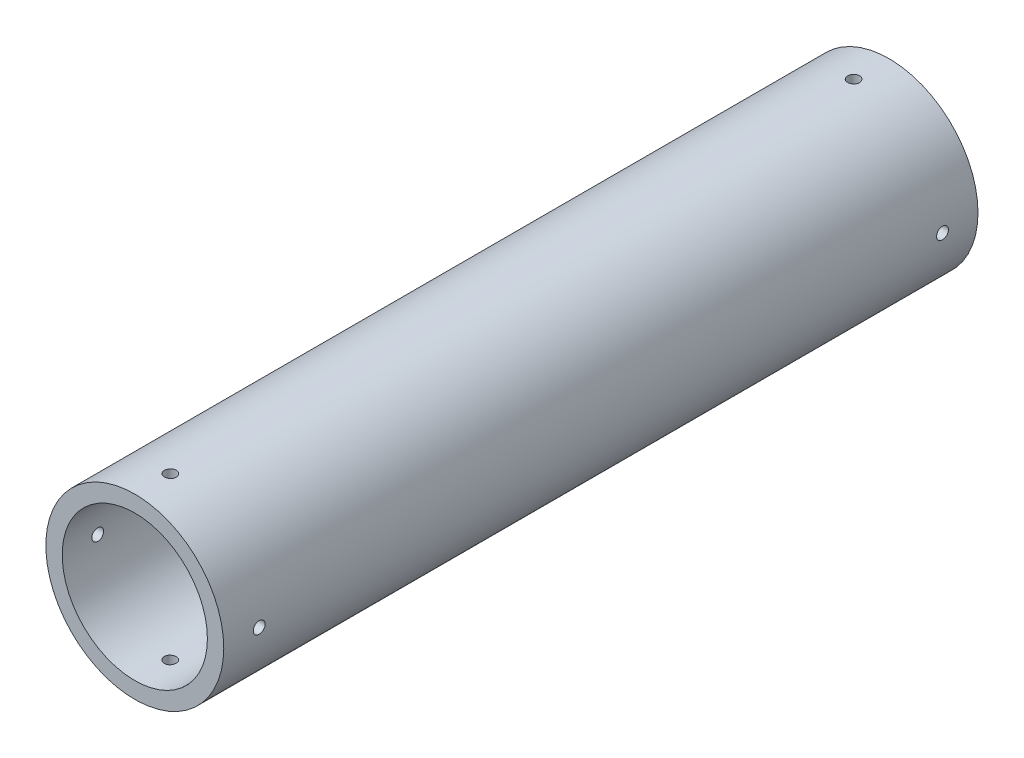
from build123d import *

# Parameters (mm, degrees)
SKETCH1_R                           = 30.099
SKETCH1_R_2                         = 24.5618
BOSS_EXTRUDE1_DEPTH                 = 255.2
F_4_0MM_DOWEL_HOLE1_D               = 4
F_4_0MM_DOWEL_HOLE1_DEPTH           = 6
F_4_0MM_DOWEL_HOLE1_TIP             = 1.201721238
F_4_0MM_DOWEL_HOLE1_ON_FACE_2_D     = 4
F_4_0MM_DOWEL_HOLE1_ON_FACE_2_DEPTH = 6
F_4_0MM_DOWEL_HOLE1_ON_FACE_2_TIP   = 1.201721238
F_4_0MM_DOWEL_HOLE1_ON_FACE_3_D     = 4
F_4_0MM_DOWEL_HOLE1_ON_FACE_3_DEPTH = 6
F_4_0MM_DOWEL_HOLE1_ON_FACE_3_TIP   = 1.201721238
F_4_0MM_DOWEL_HOLE1_ON_FACE_4_D     = 4
F_4_0MM_DOWEL_HOLE1_ON_FACE_4_DEPTH = 6
F_4_0MM_DOWEL_HOLE1_ON_FACE_4_TIP   = 1.201721238
F_4_0MM_DOWEL_HOLE2_D               = 4
F_4_0MM_DOWEL_HOLE2_DEPTH           = 6
F_4_0MM_DOWEL_HOLE2_TIP             = 1.201721238
F_4_0MM_DOWEL_HOLE2_ON_FACE_2_D     = 4
F_4_0MM_DOWEL_HOLE2_ON_FACE_2_DEPTH = 6
F_4_0MM_DOWEL_HOLE2_ON_FACE_2_TIP   = 1.201721238
F_4_0MM_DOWEL_HOLE2_ON_FACE_3_D     = 4
F_4_0MM_DOWEL_HOLE2_ON_FACE_3_DEPTH = 6
F_4_0MM_DOWEL_HOLE2_ON_FACE_3_TIP   = 1.201721238
F_4_0MM_DOWEL_HOLE2_ON_FACE_4_D     = 4
F_4_0MM_DOWEL_HOLE2_ON_FACE_4_DEPTH = 6
F_4_0MM_DOWEL_HOLE2_ON_FACE_4_TIP   = 1.201721238


with BuildPart() as part:
    # Sketch1 → Boss-Extrude1 (new body)
    with BuildSketch(Plane.XY):
        Circle(SKETCH1_R)
        Circle(SKETCH1_R_2, mode=Mode.SUBTRACT)
    extrude(amount=BOSS_EXTRUDE1_DEPTH)

    # Ø4.0mm Dowel Hole1
    with Locations(Plane(origin=(0, 30.099, 12), x_dir=(1, 0, 0), z_dir=(0, 1, 0))):
        with Locations((0, 0)):
            Hole(F_4_0MM_DOWEL_HOLE1_D / 2, depth=F_4_0MM_DOWEL_HOLE1_DEPTH)
            with Locations((0, 0, -(F_4_0MM_DOWEL_HOLE1_DEPTH + F_4_0MM_DOWEL_HOLE1_TIP / 2))):  # 118° drill point
                Cone(0, F_4_0MM_DOWEL_HOLE1_D / 2, F_4_0MM_DOWEL_HOLE1_TIP, mode=Mode.SUBTRACT)

    # Ø4.0mm Dowel Hole1 on face 2
    with Locations(Plane(origin=(30.099, 0, 12), x_dir=(0, 0, 1), z_dir=(1, 0, 0))):
        with Locations((0, 0)):
            Hole(F_4_0MM_DOWEL_HOLE1_ON_FACE_2_D / 2, depth=F_4_0MM_DOWEL_HOLE1_ON_FACE_2_DEPTH)
            with Locations((0, 0, -(F_4_0MM_DOWEL_HOLE1_ON_FACE_2_DEPTH + F_4_0MM_DOWEL_HOLE1_ON_FACE_2_TIP / 2))):  # 118° drill point
                Cone(0, F_4_0MM_DOWEL_HOLE1_ON_FACE_2_D / 2, F_4_0MM_DOWEL_HOLE1_ON_FACE_2_TIP, mode=Mode.SUBTRACT)

    # Ø4.0mm Dowel Hole1 on face 3
    with Locations(Plane(origin=(0, -30.099, 12), x_dir=(0, 0, -1), z_dir=(0, -1, 0))):
        with Locations((0, 0)):
            Hole(F_4_0MM_DOWEL_HOLE1_ON_FACE_3_D / 2, depth=F_4_0MM_DOWEL_HOLE1_ON_FACE_3_DEPTH)
            with Locations((0, 0, -(F_4_0MM_DOWEL_HOLE1_ON_FACE_3_DEPTH + F_4_0MM_DOWEL_HOLE1_ON_FACE_3_TIP / 2))):  # 118° drill point
                Cone(0, F_4_0MM_DOWEL_HOLE1_ON_FACE_3_D / 2, F_4_0MM_DOWEL_HOLE1_ON_FACE_3_TIP, mode=Mode.SUBTRACT)

    # Ø4.0mm Dowel Hole1 on face 4
    with Locations(Plane(origin=(-30.099, 0, 12), x_dir=(0, 0, -1), z_dir=(-1, 0, 0))):
        with Locations((0, 0)):
            Hole(F_4_0MM_DOWEL_HOLE1_ON_FACE_4_D / 2, depth=F_4_0MM_DOWEL_HOLE1_ON_FACE_4_DEPTH)
            with Locations((0, 0, -(F_4_0MM_DOWEL_HOLE1_ON_FACE_4_DEPTH + F_4_0MM_DOWEL_HOLE1_ON_FACE_4_TIP / 2))):  # 118° drill point
                Cone(0, F_4_0MM_DOWEL_HOLE1_ON_FACE_4_D / 2, F_4_0MM_DOWEL_HOLE1_ON_FACE_4_TIP, mode=Mode.SUBTRACT)

    # Ø4.0mm Dowel Hole2
    with Locations(Plane(origin=(0, -30.099, 243.2), x_dir=(-1, 0, 0), z_dir=(0, -1, 0))):
        with Locations((0, 0)):
            Hole(F_4_0MM_DOWEL_HOLE2_D / 2, depth=F_4_0MM_DOWEL_HOLE2_DEPTH)
            with Locations((0, 0, -(F_4_0MM_DOWEL_HOLE2_DEPTH + F_4_0MM_DOWEL_HOLE2_TIP / 2))):  # 118° drill point
                Cone(0, F_4_0MM_DOWEL_HOLE2_D / 2, F_4_0MM_DOWEL_HOLE2_TIP, mode=Mode.SUBTRACT)

    # Ø4.0mm Dowel Hole2 on face 2
    with Locations(Plane(origin=(-30.099, 0, 243.2), x_dir=(0, 0, -1), z_dir=(-1, 0, 0))):
        with Locations((0, 0)):
            Hole(F_4_0MM_DOWEL_HOLE2_ON_FACE_2_D / 2, depth=F_4_0MM_DOWEL_HOLE2_ON_FACE_2_DEPTH)
            with Locations((0, 0, -(F_4_0MM_DOWEL_HOLE2_ON_FACE_2_DEPTH + F_4_0MM_DOWEL_HOLE2_ON_FACE_2_TIP / 2))):  # 118° drill point
                Cone(0, F_4_0MM_DOWEL_HOLE2_ON_FACE_2_D / 2, F_4_0MM_DOWEL_HOLE2_ON_FACE_2_TIP, mode=Mode.SUBTRACT)

    # Ø4.0mm Dowel Hole2 on face 3
    with Locations(Plane(origin=(0, 30.099, 243.2), x_dir=(0, 0, 1), z_dir=(0, 1, 0))):
        with Locations((0, 0)):
            Hole(F_4_0MM_DOWEL_HOLE2_ON_FACE_3_D / 2, depth=F_4_0MM_DOWEL_HOLE2_ON_FACE_3_DEPTH)
            with Locations((0, 0, -(F_4_0MM_DOWEL_HOLE2_ON_FACE_3_DEPTH + F_4_0MM_DOWEL_HOLE2_ON_FACE_3_TIP / 2))):  # 118° drill point
                Cone(0, F_4_0MM_DOWEL_HOLE2_ON_FACE_3_D / 2, F_4_0MM_DOWEL_HOLE2_ON_FACE_3_TIP, mode=Mode.SUBTRACT)

    # Ø4.0mm Dowel Hole2 on face 4
    with Locations(Plane(origin=(30.099, 0, 243.2), x_dir=(0, 0, 1), z_dir=(1, 0, 0))):
        with Locations((0, 0)):
            Hole(F_4_0MM_DOWEL_HOLE2_ON_FACE_4_D / 2, depth=F_4_0MM_DOWEL_HOLE2_ON_FACE_4_DEPTH)
            with Locations((0, 0, -(F_4_0MM_DOWEL_HOLE2_ON_FACE_4_DEPTH + F_4_0MM_DOWEL_HOLE2_ON_FACE_4_TIP / 2))):  # 118° drill point
                Cone(0, F_4_0MM_DOWEL_HOLE2_ON_FACE_4_D / 2, F_4_0MM_DOWEL_HOLE2_ON_FACE_4_TIP, mode=Mode.SUBTRACT)


solid = part.part
